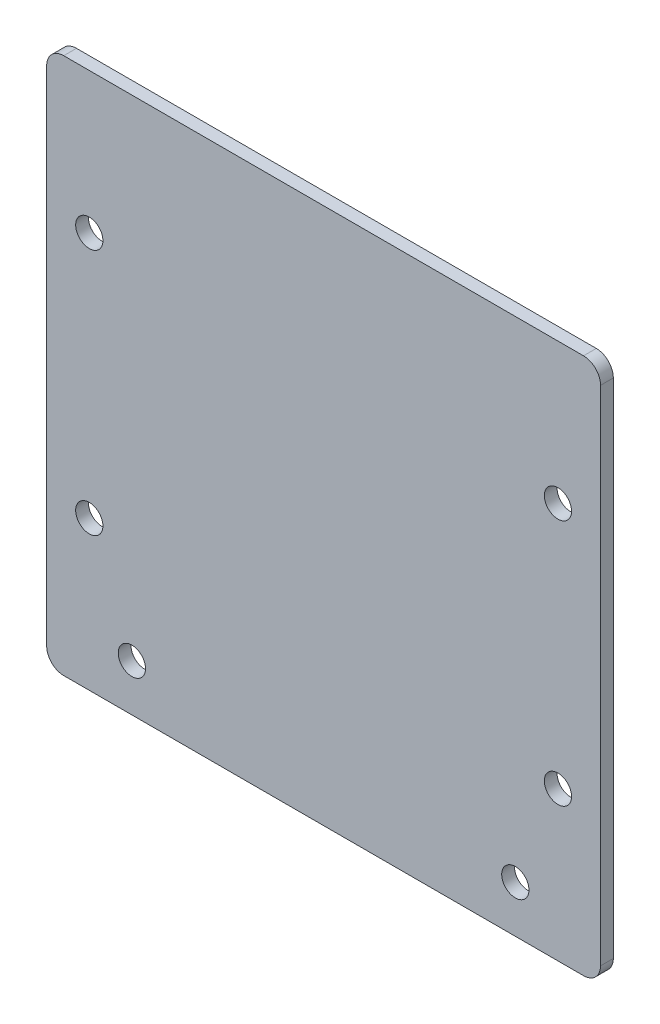
from build123d import *

# Parameters (mm, degrees)
SKETCH_2_W      = 65
SKETCH_2_H      = 63
SKETCH_2_R      = 1.6
EXTRUDE_1_DEPTH = 1.5
FILLET_1_R      = 2


with BuildPart() as part:
    # 草图2 → 凸台-拉伸1 (new body)
    with BuildSketch(Plane.XY):
        Rectangle(SKETCH_2_W, SKETCH_2_H)
        with Locations((-27.5, -14)):
            Circle(SKETCH_2_R, mode=Mode.SUBTRACT)
        with Locations((-27.5, 15)):
            Circle(SKETCH_2_R, mode=Mode.SUBTRACT)
        with Locations((27.5, 15)):
            Circle(SKETCH_2_R, mode=Mode.SUBTRACT)
        with Locations((27.5, -14)):
            Circle(SKETCH_2_R, mode=Mode.SUBTRACT)
        with Locations((22.5, -26)):
            Circle(SKETCH_2_R, mode=Mode.SUBTRACT)
        with Locations((-22.5, -26)):
            Circle(SKETCH_2_R, mode=Mode.SUBTRACT)
    extrude(amount=EXTRUDE_1_DEPTH)

    # 圆角1
    fillet_1_edges = [part.edges().sort_by_distance(p)[0] for p in [
        (32.5, -31.5, 0.75),
        (-32.5, -31.5, 0.75),
        (-32.5, 31.5, 0.75),
        (32.5, 31.5, 0.75),
    ]]
    fillet(fillet_1_edges, radius=FILLET_1_R)


solid = part.part
